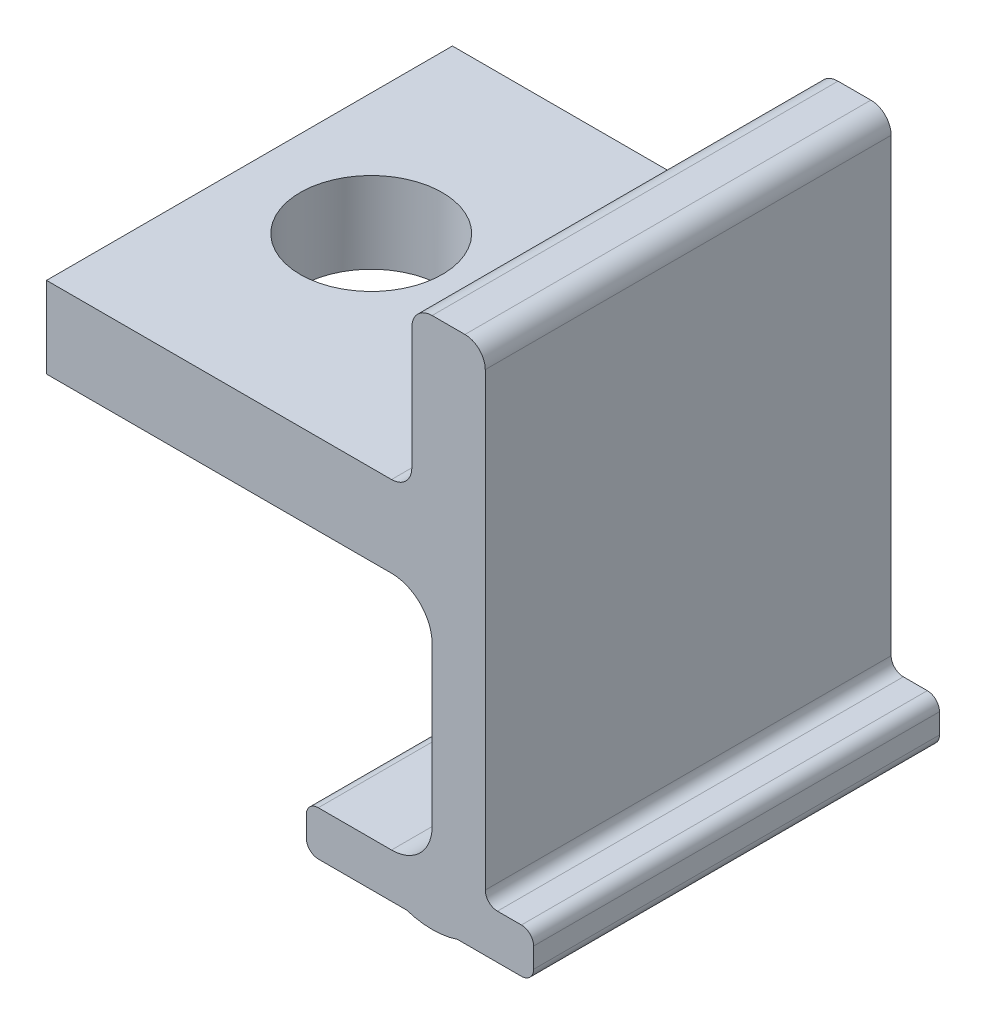
from build123d import *

# Parameters (mm, degrees)
BOSS_EXTRUDE1_DEPTH  = 10
M3_CLEARANCE_HOLE1_D = 3.5
CUT_EXTRUDE1_DEPTH   = 10
CUT_EXTRUDE2_START   = -10
CUT_EXTRUDE2_DEPTH   = 10


with BuildPart() as part:
    # Sketch1 → Boss-Extrude1 (new body)
    with BuildSketch(Plane.XY):
        with BuildLine():
            Line((0, 0), (8, 0))
            Line((8, 0), (8.5, 0))
            ThreePointArc((8.5, 0), (8.853553391, 0.146446609), (9, 0.5))
            Line((9, 0.5), (9, 3.5))
            ThreePointArc((9, 3.5), (9.146446609, 3.853553391), (9.5, 4))
            Line((9.5, 4), (10.309420257, 4))
            ThreePointArc((10.309420257, 4), (10.662973647, 3.853553391), (10.809420257, 3.5))
            Line((10.809420257, 3.5), (10.809420257, -7.604196011))
            ThreePointArc((10.809420257, -7.604196011), (10.897288222, -7.816328045), (11.109420257, -7.904196011))
            Line((11.109420257, -7.904196011), (11.7, -7.904196011))
            ThreePointArc((11.7, -7.904196011), (11.912132034, -7.992063976), (12, -8.204196011))
            Line((12, -8.204196011), (12, -8.7))
            ThreePointArc((12, -8.7), (11.912132034, -8.912132034), (11.7, -9))
            Line((11.7, -9), (10.1244998, -9))
            ThreePointArc((10.1244998, -9), (9.5, -9.1), (8.8755002, -9))
            Line((8.8755002, -9), (6.3, -9))
            ThreePointArc((6.3, -9), (6.087867966, -8.912132034), (6, -8.7))
            Line((6, -8.7), (6, -8.2))
            ThreePointArc((6, -8.2), (6.070871215, -8.006350833), (6.25, -7.904196011))
            ThreePointArc((6.25, -7.904196011), (6.429128785, -7.802041189), (6.5, -7.608392022))
            Line((6.5, -7.608392022), (6.5, -2.2))
            ThreePointArc((6.5, -2.2), (6.441421356, -2.058578644), (6.3, -2))
            Line((6.3, -2), (0, -2))
            Line((0, -2), (0, 0))
        make_face()
    extrude(amount=BOSS_EXTRUDE1_DEPTH)

    # M3 Clearance Hole1 (through all)
    with Locations(Plane(origin=(0, 0, 0), x_dir=(1, 0, 0), z_dir=(0, 1, 0))):
        with Locations((3, -5)):
            Hole(M3_CLEARANCE_HOLE1_D / 2)

    # Sketch4 → Cut-Extrude1 (cut)
    with BuildSketch(Plane.XY.offset(10)):
        with BuildLine():
            Line((5.764081335, -2), (8.5, -2))
            ThreePointArc((8.5, -2), (9.207106781, -2.292893219), (9.5, -3))
            Line((9.5, -3), (9.5, -6.904196011))
            ThreePointArc((9.5, -6.904196011), (9.207106781, -7.611302792), (8.5, -7.904196011))
            Line((8.5, -7.904196011), (5.764081335, -7.904196011))
            Line((5.764081335, -7.904196011), (5.764081335, -2))
        make_face()
    extrude(amount=-CUT_EXTRUDE1_DEPTH, mode=Mode.SUBTRACT)

    # Sketch6 → Cut-Extrude2 (cut)
    with BuildSketch(Plane.XY.offset(10).offset(CUT_EXTRUDE2_START)):
        with BuildLine():
            Line((6.4, -8.2), (6.4, -8.7))
            ThreePointArc((6.4, -8.7), (6.487867966, -8.912132034), (6.7, -9))
            Line((6.7, -9), (6.3, -9))
            ThreePointArc((6.3, -9), (6.087867966, -8.912132034), (6, -8.7))
            Line((6, -8.7), (6, -8.2))
            ThreePointArc((6, -8.2), (6.070871215, -8.006350833), (6.25, -7.904196011))
            Line((6.25, -7.904196011), (6.695803989, -7.904196011))
            ThreePointArc((6.695803989, -7.904196011), (6.486638983, -7.990834993), (6.4, -8.2))
        make_face()
    extrude(amount=CUT_EXTRUDE2_DEPTH, mode=Mode.SUBTRACT)


solid = part.part
